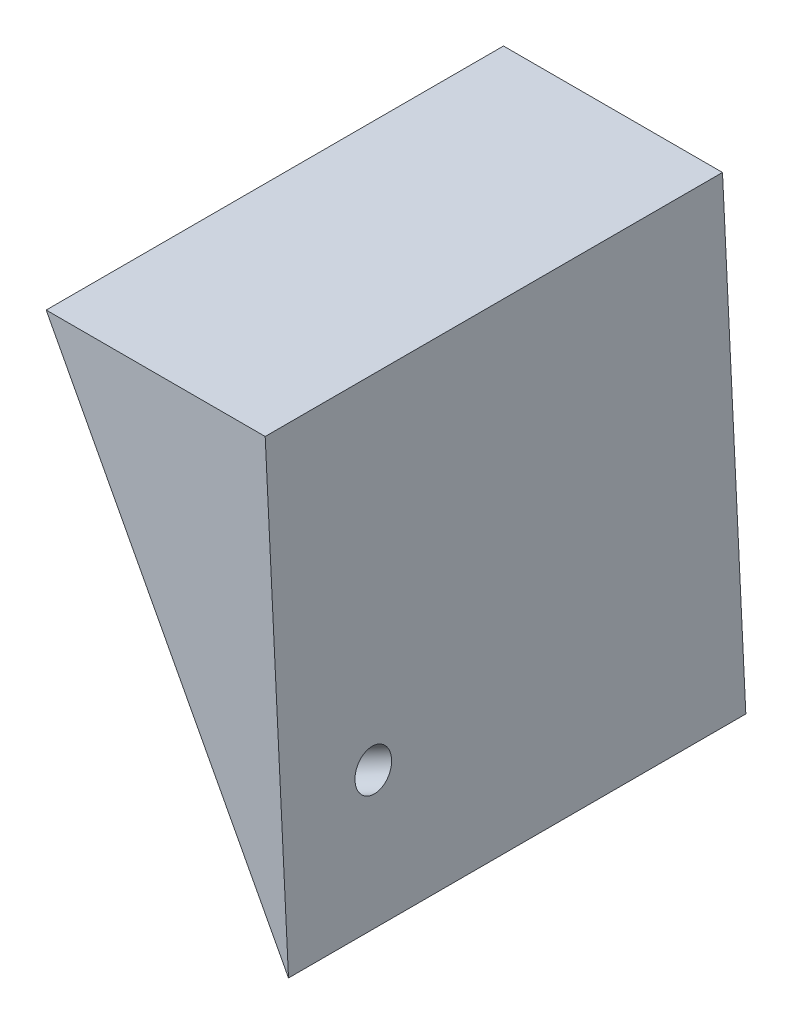
from build123d import *

# Parameters (mm, degrees)
BOSS_EXTRUDE1_DEPTH = 50
SKETCH2_R           = 2
CUT_EXTRUDE1_DEPTH  = 50


with BuildPart() as part:
    # Sketch1 → Boss-Extrude1 (new body)
    with BuildSketch(Plane.XY):
        Polygon((-36.238637744, 19.241346543), (-9.742760301, -30.758653457), (-12.293063224, 19.241346543), align=None)
    extrude(amount=BOSS_EXTRUDE1_DEPTH)

    # Sketch2 → Cut-Extrude1 (cut)
    with BuildSketch(Plane(origin=(-20.332646925, -10.77462642, 0), x_dir=(0, 0, 1), z_dir=(-0.8836030430860086, -0.4682367587547406, 0))):
        with Locations(Location((40, -9.616521291, 0), (0, 0, 270))):
            Circle(SKETCH2_R)
    extrude(amount=-CUT_EXTRUDE1_DEPTH, mode=Mode.SUBTRACT)


solid = part.part
